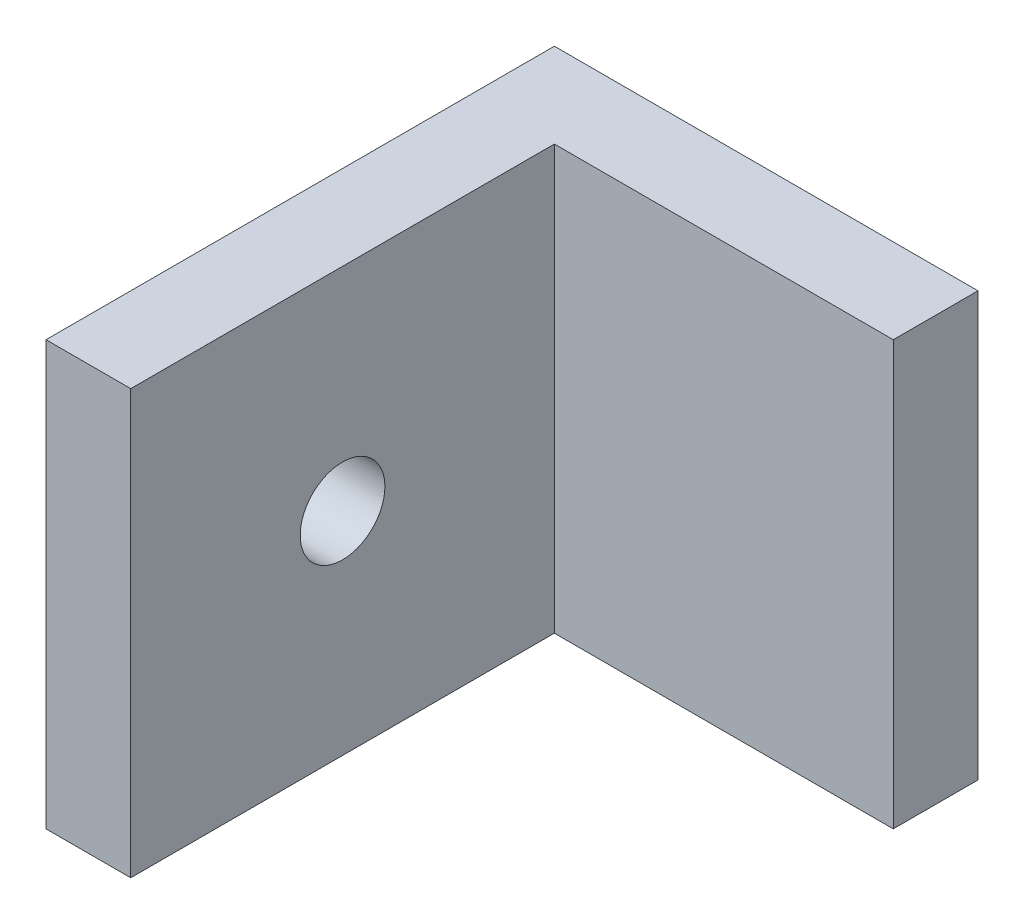
from build123d import *

# Parameters (mm, degrees)
SKETCH1_W           = 30
SKETCH1_H           = 30
BOSS_EXTRUDE1_DEPTH = 6
SKETCH2_W           = 6
SKETCH2_H           = 30
BOSS_EXTRUDE2_DEPTH = 30
SKETCH3_R           = 3
CUT_EXTRUDE1_DEPTH  = 46.793012567


with BuildPart() as part:
    # Sketch1 → Boss-Extrude1 (new body)
    with BuildSketch(Plane.XY):
        Rectangle(SKETCH1_W, SKETCH1_H)
    extrude(amount=BOSS_EXTRUDE1_DEPTH)

    # Sketch2 → Boss-Extrude2 (add)
    with BuildSketch(Plane.XY.offset(6)):
        with Locations((-12, 0)):
            Rectangle(SKETCH2_W, SKETCH2_H)
    extrude(amount=BOSS_EXTRUDE2_DEPTH)

    # Sketch3 → Cut-Extrude1 (cut, through all)
    with BuildSketch(Plane(origin=(-9, 0, 0), x_dir=(0, 0, -1), z_dir=(1, 0, 0))):
        with Locations((-21, 0)):
            Circle(SKETCH3_R)
    extrude(amount=-CUT_EXTRUDE1_DEPTH, mode=Mode.SUBTRACT)


solid = part.part
